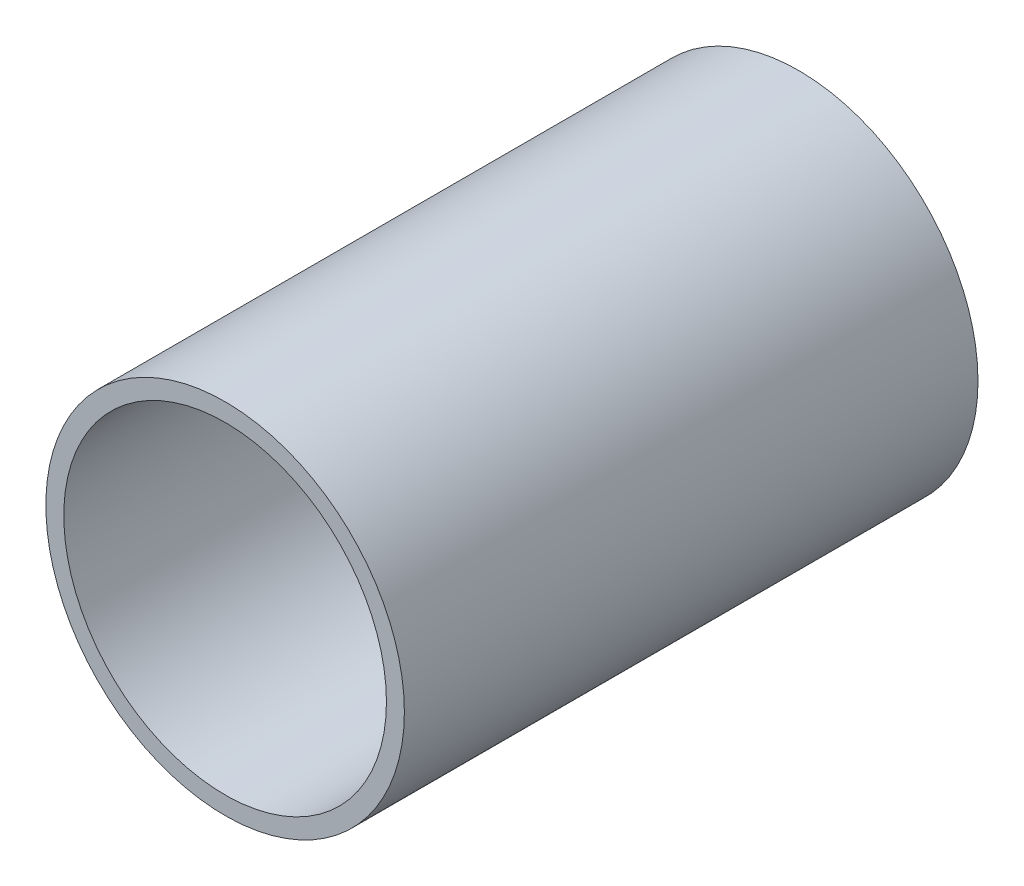
from build123d import *

# Parameters (mm, degrees)
SKETCH1_R           = 50
SKETCH1_R_2         = 45
BOSS_EXTRUDE1_DEPTH = 80


with BuildPart() as part:
    # Sketch1 → Boss-Extrude1 (new, symmetric)
    with BuildSketch(Plane.XY):
        Circle(SKETCH1_R)
        Circle(SKETCH1_R_2, mode=Mode.SUBTRACT)
    extrude(amount=BOSS_EXTRUDE1_DEPTH, both=True)


solid = part.part
